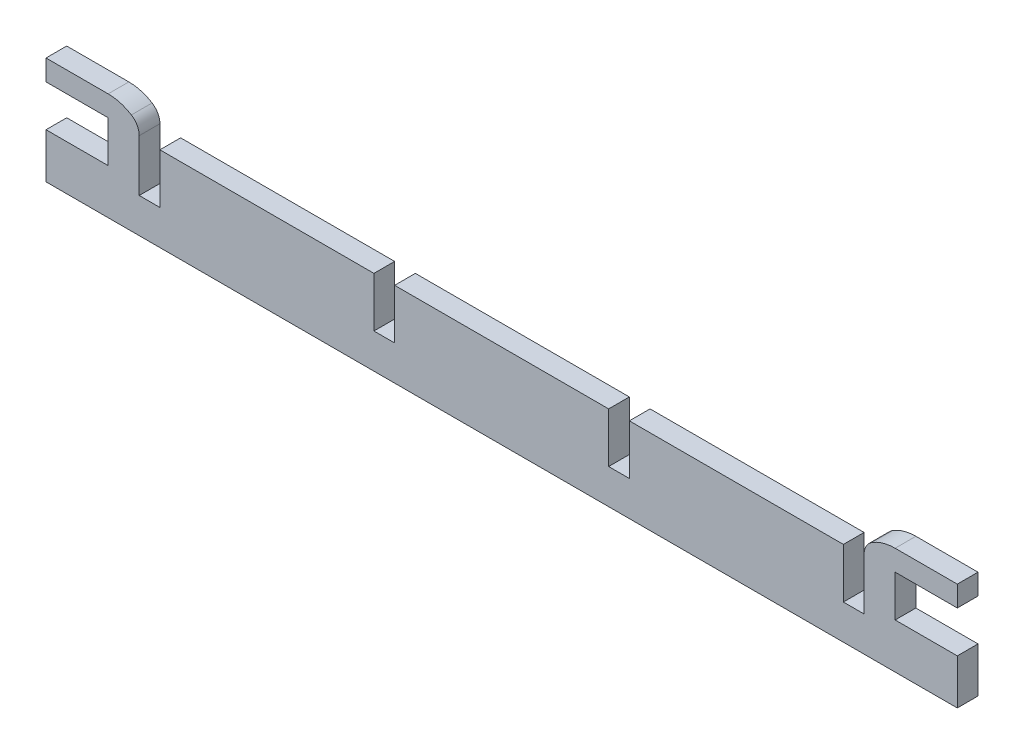
from build123d import *

# Parameters (mm, degrees)
BOSS_EXTRUDE1_DEPTH = 6.35
SKETCH2_W           = 6.35
SKETCH2_H           = 15.306086647
CUT_EXTRUDE1_DEPTH  = 281.120661501


with BuildPart() as part:
    # Sketch1 → Boss-Extrude1 (new body)
    with BuildSketch(Plane.XY):
        with BuildLine():
            Line((0, 0), (19.05, 0))
            Line((19.05, 0), (19.05, 12.7))
            Line((19.05, 12.7), (0, 12.7))
            Line((0, 12.7), (0, 19.05))
            Line((0, 19.05), (19.05, 19.05))
            ThreePointArc((19.05, 19.05), (22.75701822, 18.530813768), (26.178773585, 17.013207547))
            ThreePointArc((26.178773585, 17.013207547), (27.935718963, 15.16706609), (28.575, 12.7))
            Line((28.575, 12.7), (28.575, 0))
            Line((28.575, 0), (28.575, -3.175))
            Line((28.575, -3.175), (34.925, -3.175))
            Line((34.925, -3.175), (34.925, 12.131086647))
            Line((34.925, 12.131086647), (139.7, 12.131086647))
            Line((139.7, 12.131086647), (139.7, -13.843))
            Line((139.7, -13.843), (0, -13.843))
            Line((0, -13.843), (0, 0))
        make_face()
    boss_extrude1 = extrude(amount=BOSS_EXTRUDE1_DEPTH)

    # Mirror1: Boss-Extrude1 across plane
    add(boss_extrude1.mirror(Plane(origin=(139.7, 12.131086647, 6.35), x_dir=(0, 0, 1), z_dir=(-1, 0, 0))))

    # Sketch2 → Cut-Extrude1 (cut, through all)
    with BuildSketch(Plane.XY.offset(6.35)):
        with Locations((103.716666667, 4.478043323)):
            Rectangle(SKETCH2_W, SKETCH2_H)
        with Locations((175.683333333, 4.478043323)):
            Rectangle(SKETCH2_W, SKETCH2_H)
    extrude(amount=-CUT_EXTRUDE1_DEPTH, mode=Mode.SUBTRACT)


solid = part.part
